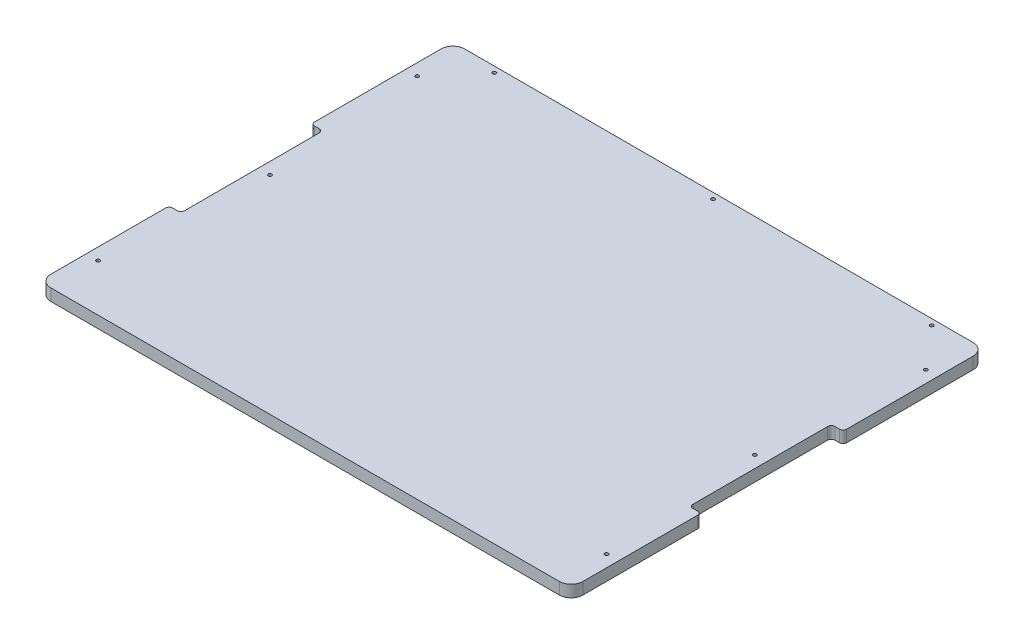
from build123d import *

# Parameters (mm, degrees)
SKETCH1_W           = 450
SKETCH1_H           = 350
BOSS_EXTRUDE1_DEPTH = 10
SKETCH2_R           = 3
CUT_EXTRUDE1_DEPTH  = 10
SKETCH3_W           = 10
SKETCH3_H           = 120
CUT_EXTRUDE2_DEPTH  = 10
FILLET1_R           = 3
FILLET2_R           = 3
FILLET3_R           = 10
SKETCH5_R           = 3
BOSS_EXTRUDE3_DEPTH = 10
SKETCH6_R           = 3
BOSS_EXTRUDE4_DEPTH = 10
SKETCH7_R           = 1.5
CUT_EXTRUDE3_DEPTH  = 10


with BuildPart() as part:
    # Sketch1 → Boss-Extrude1 (new body)
    with BuildSketch(Plane(origin=(0, 0, 0), x_dir=(1, 0, 0), z_dir=(0, 1, 0))):
        Rectangle(SKETCH1_W, SKETCH1_H)
    extrude(amount=BOSS_EXTRUDE1_DEPTH)

    # Sketch2 → Cut-Extrude1 (cut)
    with BuildSketch(Plane(origin=(0, 10, 0), x_dir=(1, 0, 0), z_dir=(0, 1, 0))):
        with Locations(Location((-215, -135, 0), (0, 0, 270))):
            Circle(SKETCH2_R)
        with Locations(Location((-205, 0.370879822, 0), (0, 0, 270))):
            Circle(SKETCH2_R)
        with Locations(Location((-215, 135, 0), (0, 0, 270))):
            Circle(SKETCH2_R)
        with Locations(Location((215, 135, 0), (0, 0, 270))):
            Circle(SKETCH2_R)
        with Locations(Location((205, 0, 0), (0, 0, 270))):
            Circle(SKETCH2_R)
        with Locations(Location((215, -135, 0), (0, 0, 270))):
            Circle(SKETCH2_R)
        with Locations(Location((-185, 170, 0), (0, 0, 270))):
            Circle(SKETCH2_R)
        with Locations(Location((0, 170, 0), (0, 0, 270))):
            Circle(SKETCH2_R)
        with Locations(Location((185, 170, 0), (0, 0, 270))):
            Circle(SKETCH2_R)
    extrude(amount=-CUT_EXTRUDE1_DEPTH, mode=Mode.SUBTRACT)

    # Sketch3 → Cut-Extrude2 (cut)
    with BuildSketch(Plane(origin=(0, 10, 0), x_dir=(1, 0, 0), z_dir=(0, 1, 0))):
        with Locations((-220, -5)):
            Rectangle(SKETCH3_W, SKETCH3_H)
        with Locations((220, -5)):
            Rectangle(SKETCH3_W, SKETCH3_H)
    extrude(amount=-CUT_EXTRUDE2_DEPTH, mode=Mode.SUBTRACT)

    # Fillet1
    fillet1_edges = [part.edges().sort_by_distance(p)[0] for p in [
        (-215, 5, -55),
        (-215, 5, 65),
        (215, 5, 65),
        (215, 5, -55),
    ]]
    fillet(fillet1_edges, radius=FILLET1_R)

    # Fillet2
    fillet2_edges = [part.edges().sort_by_distance(p)[0] for p in [
        (-225, 5, 65),
        (-225, 5, -55),
        (225, 5, -55),
        (225, 5, 65),
    ]]
    fillet(fillet2_edges, radius=FILLET2_R)

    # Fillet3
    fillet3_edges = [part.edges().sort_by_distance(p)[0] for p in [
        (-225, 5, -175),
        (225, 5, -175),
        (225, 5, 175),
        (-225, 5, 175),
    ]]
    fillet(fillet3_edges, radius=FILLET3_R)

    # Sketch5 → Boss-Extrude3 (add)
    with BuildSketch(Plane(origin=(0, 10, 0), x_dir=(1, 0, 0), z_dir=(0, 1, 0))):
        with Locations((-215, 135)):
            Circle(SKETCH5_R)
    extrude(amount=-BOSS_EXTRUDE3_DEPTH)

    # Sketch6 → Boss-Extrude4 (add)
    with BuildSketch(Plane(origin=(0, 10, 0), x_dir=(1, 0, 0), z_dir=(0, 1, 0))):
        with Locations((-185, 170)):
            Circle(SKETCH6_R)
        with Locations((0, 170)):
            Circle(SKETCH6_R)
        with Locations((185, 170)):
            Circle(SKETCH6_R)
        with Locations((215, 135)):
            Circle(SKETCH6_R)
        with Locations((205, 0)):
            Circle(SKETCH6_R)
        with Locations((215, -135)):
            Circle(SKETCH6_R)
        with Locations((-215, -135)):
            Circle(SKETCH6_R)
        with Locations((-205, 0.370879822)):
            Circle(SKETCH6_R)
    extrude(amount=-BOSS_EXTRUDE4_DEPTH)

    # Sketch7 → Cut-Extrude3 (cut)
    with BuildSketch(Plane(origin=(0, 10, 0), x_dir=(1, 0, 0), z_dir=(0, 1, 0))):
        with Locations(Location((-185, 170, 0), (0, 0, 270))):
            Circle(SKETCH7_R)
        with Locations(Location((-215.140831726, 135, 0), (0, 0, 270))):
            Circle(SKETCH7_R)
        with Locations(Location((-205, 0.381414612, 0), (0, 0, 270))):
            Circle(SKETCH7_R)
        with Locations(Location((-215, -135, 0), (0, 0, 270))):
            Circle(SKETCH7_R)
        with Locations(Location((215, -135, 0), (0, 0, 270))):
            Circle(SKETCH7_R)
        with Locations(Location((205, 0.370879822, 0), (0, 0, 270))):
            Circle(SKETCH7_R)
        with Locations(Location((215, 135, 0), (0, 0, 270))):
            Circle(SKETCH7_R)
        with Locations(Location((0, 170, 0), (0, 0, 270))):
            Circle(SKETCH7_R)
        with Locations(Location((185, 170, 0), (0, 0, 270))):
            Circle(SKETCH7_R)
    extrude(amount=-CUT_EXTRUDE3_DEPTH, mode=Mode.SUBTRACT)


solid = part.part
